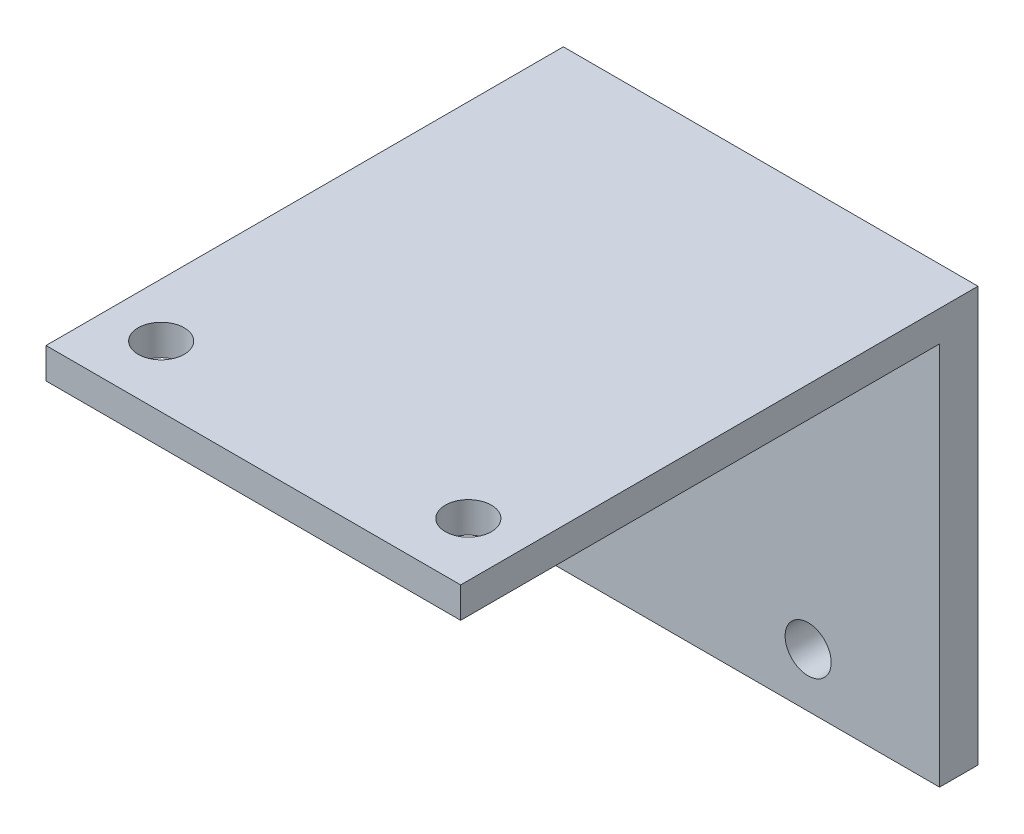
from build123d import *

# Parameters (mm, degrees)
ESQUISSE1_W             = 54
ESQUISSE1_H             = 54
ESQUISSE1_R             = 3
BOSS_EXTRU_1_DEPTH      = 67.37
ESQUISSE2_W             = 85.887974464
ESQUISSE2_H             = 58.790343592
ENL_V_MAT_EXTRU_1_DEPTH = 62.37
ESQUISSE3_R             = 3
ENL_V_MAT_EXTRU_2_DEPTH = 62.37


with BuildPart() as part:
    # Esquisse1 → Boss.-Extru.1 (new body)
    with BuildSketch(Plane.XY):
        Rectangle(ESQUISSE1_W, ESQUISSE1_H)
        with Locations((9.88, 20)):
            Circle(ESQUISSE1_R, mode=Mode.SUBTRACT)
        with Locations((9.88, -20)):
            Circle(ESQUISSE1_R, mode=Mode.SUBTRACT)
    extrude(amount=BOSS_EXTRU_1_DEPTH)

    # Esquisse2 → Enlèv. mat.-Extru.1 (cut)
    with BuildSketch(Plane.XY.offset(67.37)):
        with Locations((-4.168944697, -6.395171796)):
            Rectangle(ESQUISSE2_W, ESQUISSE2_H)
    extrude(amount=-ENL_V_MAT_EXTRU_1_DEPTH, mode=Mode.SUBTRACT)

    # Esquisse3 → Enlèv. mat.-Extru.2 (cut)
    with BuildSketch(Plane.XZ.offset(-23)):
        with Locations(Location((-20, 59.37, 0), (0, 0, 270))):
            Circle(ESQUISSE3_R)
        with Locations(Location((20, 59.37, 0), (0, 0, 270))):
            Circle(ESQUISSE3_R)
    extrude(amount=-ENL_V_MAT_EXTRU_2_DEPTH, mode=Mode.SUBTRACT)


solid = part.part
